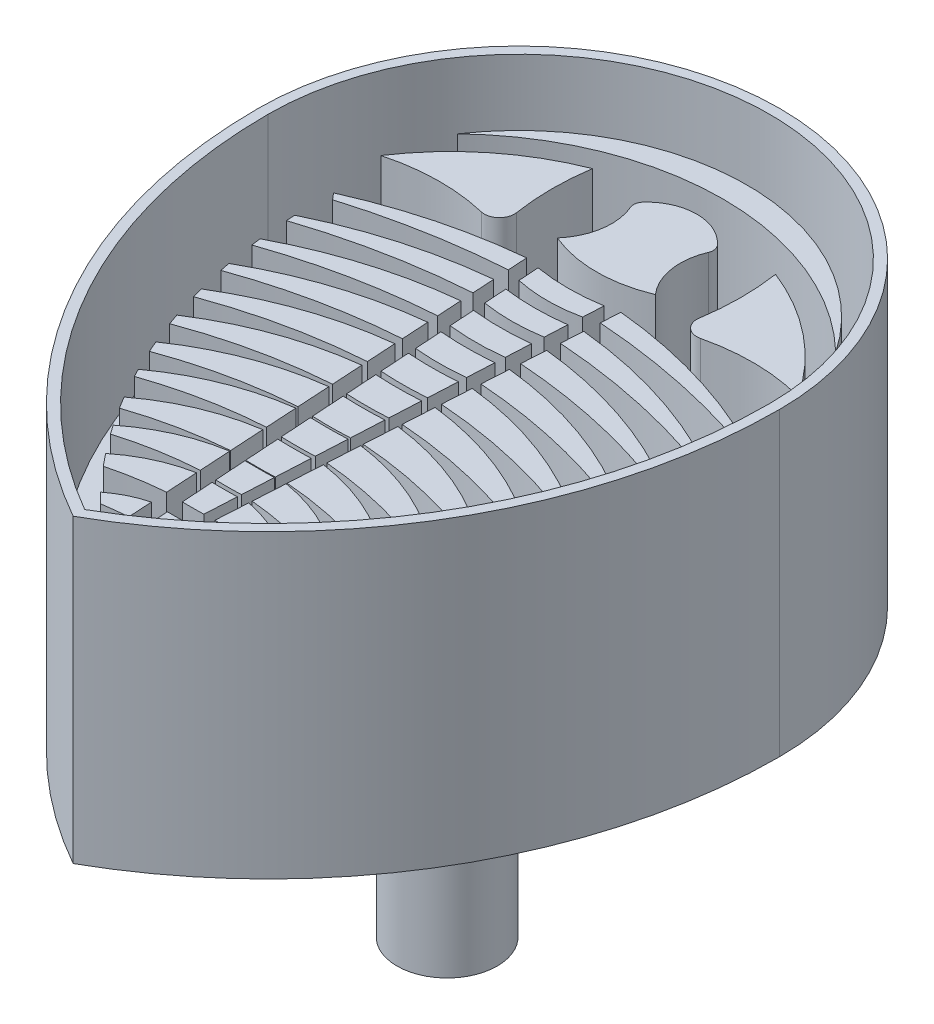
from build123d import *

# Parameters (mm, degrees)
P_IDAT_VYSUNUT_M1_DEPTH     = 3
P_IDAT_VYSUNUT_M2_DEPTH     = 2
VYSUNOUT_TENKOST_NN_1_DEPTH = 3
SKICA4_R                    = 1
P_IDAT_VYSUNUT_M3_DEPTH     = 5
M_TKO2_SCALE                = 10


with BuildPart() as part:
    # Skica1 → Přidat vysunutím1 (new body)
    with BuildSketch(Plane(origin=(0, 0, 0), x_dir=(1, 0, 0), z_dir=(0, 1, 0))):
        with BuildLine():
            ThreePointArc((5, 0), (0, 5), (-5, 0))
            ThreePointArc((-5, 0), (-3.660254038, -5), (0, -8.660254038))
            ThreePointArc((0, -8.660254038), (3.660254038, -5), (5, 0))
        make_face()
    extrude(amount=-P_IDAT_VYSUNUT_M1_DEPTH)

    # Skica2 → Přidat vysunutím2 (add)
    with BuildSketch(Plane(origin=(0, 0, 0), x_dir=(1, 0, 0), z_dir=(0, 1, 0))):
        with BuildLine():
            Line((-0.916308941, 0.705415762), (-0.939566009, 1.094601969))
            ThreePointArc((-0.939566009, 1.094601969), (-2.496070066, 0.816540474), (-3.987598771, 0.291787966))
            ThreePointArc((-3.987598771, 0.291787966), (-3.93376434, 0.226933977), (-3.878875249, 0.162970131))
            ThreePointArc((-3.878875249, 0.162970131), (-2.412884098, 0.517710206), (-0.916308941, 0.705415762))
        make_face()
        with BuildLine():
            ThreePointArc((3.996049018, 0.288019105), (2.500543522, 0.815361092), (0.939566009, 1.094601969))
            Line((0.939566009, 1.094601969), (0.916308941, 0.705415762))
            ThreePointArc((0.916308941, 0.705415762), (2.474795846, 0.50622373), (3.999244676, 0.125941382))
            ThreePointArc((3.999244676, 0.125941382), (3.997959641, 0.206986411), (3.996049018, 0.288019105))
        make_face()
        with BuildLine():
            Line((-0.435047938, -7.348056278), (-0.463870567, -6.865735387))
            ThreePointArc((-0.463870567, -6.865735387), (-0.820283032, -6.998144282), (-1.142178643, -7.200493427))
            ThreePointArc((-1.142178643, -7.200493427), (-1.044053725, -7.303235817), (-0.944547646, -7.404641136))
            ThreePointArc((-0.944547646, -7.404641136), (-0.69047942, -7.370211218), (-0.435047938, -7.348056278))
        make_face()
        with BuildLine():
            Line((-0.48311443, -6.543706568), (-0.52103385, -5.909159033))
            ThreePointArc((-0.52103385, -5.909159033), (-1.175976189, -6.119175526), (-1.759961506, -6.482517714))
            ThreePointArc((-1.759961506, -6.482517714), (-1.662000146, -6.605433643), (-1.56220985, -6.726869431))
            ThreePointArc((-1.56220985, -6.726869431), (-1.026754601, -6.611177456), (-0.48311443, -6.543706568))
        make_face()
        with BuildLine():
            ThreePointArc((1.759961506, -6.482517714), (1.175976189, -6.119175526), (0.52103385, -5.909159033))
            Line((0.52103385, -5.909159033), (0.48311443, -6.543706568))
            ThreePointArc((0.48311443, -6.543706568), (1.026754601, -6.611177456), (1.56220985, -6.726869431))
            ThreePointArc((1.56220985, -6.726869431), (1.662000146, -6.605433643), (1.759961506, -6.482517714))
        make_face()
        with BuildLine():
            Line((-0.525801188, -5.829381897), (-0.563062791, -5.205842323))
            ThreePointArc((-0.563062791, -5.205842323), (-1.413947855, -5.458574562), (-2.173892527, -5.917228103))
            ThreePointArc((-2.173892527, -5.917228103), (-2.111177401, -6.008129807), (-2.04750967, -6.098366866))
            ThreePointArc((-2.04750967, -6.098366866), (-1.294271561, -5.920788208), (-0.525801188, -5.829381897))
        make_face()
        with BuildLine():
            Line((-0.564221505, -5.186452286), (-0.605000226, -4.504056891))
            ThreePointArc((-0.605000226, -4.504056891), (-1.630072172, -4.78948348), (-2.550516325, -5.323359302))
            ThreePointArc((-2.550516325, -5.323359302), (-2.47902439, -5.443080103), (-2.405948876, -5.561840938))
            ThreePointArc((-2.405948876, -5.561840938), (-1.496899189, -5.31618491), (-0.564221505, -5.186452286))
        make_face()
        with BuildLine():
            ThreePointArc((2.550516325, -5.323359302), (1.630072172, -4.78948348), (0.605000226, -4.504056891))
            Line((0.605000226, -4.504056891), (0.564221505, -5.186452286))
            ThreePointArc((0.564221505, -5.186452286), (1.496899189, -5.31618491), (2.405948876, -5.561840938))
            ThreePointArc((2.405948876, -5.561840938), (2.47902439, -5.443080103), (2.550516325, -5.323359302))
        make_face()
        with BuildLine():
            ThreePointArc((2.888337343, -4.702033808), (1.82385638, -4.112337163), (0.646885649, -3.803141834))
            Line((0.646885649, -3.803141834), (0.608773859, -4.440908528))
            ThreePointArc((0.608773859, -4.440908528), (1.70684421, -4.611105365), (2.77208347, -4.927318553))
            ThreePointArc((2.77208347, -4.927318553), (2.83089034, -4.815027047), (2.888337343, -4.702033808))
        make_face()
        with BuildLine():
            Line((-0.609681174, -4.425725417), (-0.646885649, -3.803141834))
            ThreePointArc((-0.646885649, -3.803141834), (-1.82385638, -4.112337163), (-2.888337343, -4.702033808))
            ThreePointArc((-2.888337343, -4.702033808), (-2.846957116, -4.783763443), (-2.804865412, -4.865128946))
            ThreePointArc((-2.804865412, -4.865128946), (-1.722246967, -4.57062129), (-0.609681174, -4.425725417))
        make_face()
        with BuildLine():
            Line((-0.649768137, -3.75490598), (-0.688738665, -3.102769081))
            ThreePointArc((-0.688738665, -3.102769081), (-1.994758332, -3.427574113), (-3.185571439, -4.054590719))
            ThreePointArc((-3.185571439, -4.054590719), (-3.137074616, -4.168548051), (-3.087237062, -4.281925446))
            ThreePointArc((-3.087237062, -4.281925446), (-1.886992142, -3.932901443), (-0.649768137, -3.75490598))
        make_face()
        with BuildLine():
            ThreePointArc((3.185571439, -4.054590719), (1.994758332, -3.427574113), (0.688738665, -3.102769081))
            Line((0.688738665, -3.102769081), (0.649768137, -3.75490598))
            ThreePointArc((0.649768137, -3.75490598), (1.886992142, -3.932901443), (3.087237062, -4.281925446))
            ThreePointArc((3.087237062, -4.281925446), (3.137074616, -4.168548051), (3.185571439, -4.054590719))
        make_face()
        with BuildLine():
            ThreePointArc((3.440254888, -3.38250392), (2.142176753, -2.735637699), (0.730570119, -2.40275715))
            Line((0.730570119, -2.40275715), (0.693500935, -3.023076761))
            ThreePointArc((0.693500935, -3.023076761), (2.048697762, -3.217851436), (3.362758833, -3.602219899))
            ThreePointArc((3.362758833, -3.602219899), (3.402116283, -3.492576859), (3.440254888, -3.38250392))
        make_face()
        with BuildLine():
            Line((-0.693500935, -3.023076761), (-0.730570119, -2.40275715))
            ThreePointArc((-0.730570119, -2.40275715), (-2.142176753, -2.735637699), (-3.440254888, -3.38250392))
            ThreePointArc((-3.440254888, -3.38250392), (-3.402116283, -3.492576859), (-3.362758833, -3.602219899))
            ThreePointArc((-3.362758833, -3.602219899), (-2.048697762, -3.217851436), (-0.693500935, -3.023076761))
        make_face()
        with BuildLine():
            Line((-0.737644723, -2.28436999), (-0.772386499, -1.70299746))
            ThreePointArc((-0.772386499, -1.70299746), (-2.265442062, -2.036978997), (-3.650276137, -2.687358247))
            ThreePointArc((-3.650276137, -2.687358247), (-3.621750205, -2.792878944), (-3.592127328, -2.898096962))
            ThreePointArc((-3.592127328, -2.898096962), (-2.186526172, -2.490583797), (-0.737644723, -2.28436999))
        make_face()
        with BuildLine():
            ThreePointArc((3.650276137, -2.687358247), (2.265442062, -2.036978997), (0.772386499, -1.70299746))
            Line((0.772386499, -1.70299746), (0.737644723, -2.28436999))
            ThreePointArc((0.737644723, -2.28436999), (2.186526172, -2.490583797), (3.592127328, -2.898096962))
            ThreePointArc((3.592127328, -2.898096962), (3.621750205, -2.792878944), (3.650276137, -2.687358247))
        make_face()
        with BuildLine():
            ThreePointArc((3.813377604, -1.970848141), (2.363805986, -1.33206045), (0.814191928, -1.003421043))
            Line((0.814191928, -1.003421043), (0.782080688, -1.540773892))
            ThreePointArc((0.782080688, -1.540773892), (2.299279672, -1.75301782), (3.773049464, -2.17127951))
            ThreePointArc((3.773049464, -2.17127951), (3.793701377, -2.071161983), (3.813377604, -1.970848141))
        make_face()
        with BuildLine():
            Line((-0.782080688, -1.540773892), (-0.814191928, -1.003421043))
            ThreePointArc((-0.814191928, -1.003421043), (-2.363805986, -1.33206045), (-3.813377604, -1.970848141))
            ThreePointArc((-3.813377604, -1.970848141), (-3.793701377, -2.071161983), (-3.773049464, -2.17127951))
            ThreePointArc((-3.773049464, -2.17127951), (-2.299279672, -1.75301782), (-0.782080688, -1.540773892))
        make_face()
        with BuildLine():
            Line((-0.826716789, -0.793828702), (-0.855989148, -0.303981988))
            ThreePointArc((-0.855989148, -0.303981988), (-2.436429093, -0.621360254), (-3.927142449, -1.234787575))
            ThreePointArc((-3.927142449, -1.234787575), (-3.915520245, -1.329262214), (-3.903042076, -1.423627611))
            ThreePointArc((-3.903042076, -1.423627611), (-2.385752794, -1.006769816), (-0.826716789, -0.793828702))
        make_face()
        with BuildLine():
            ThreePointArc((3.927142449, -1.234787575), (2.436429093, -0.621360254), (0.855989148, -0.303981988))
            Line((0.855989148, -0.303981988), (0.826716789, -0.793828702))
            ThreePointArc((0.826716789, -0.793828702), (2.385752794, -1.006769816), (3.903042076, -1.423627611))
            ThreePointArc((3.903042076, -1.423627611), (3.915520245, -1.329262214), (3.927142449, -1.234787575))
        make_face()
        with BuildLine():
            ThreePointArc((3.988971171, -0.481127617), (2.482365461, 0.094622416), (0.897780057, 0.395351462))
            Line((0.897780057, 0.395351462), (0.871479662, -0.044762094))
            ThreePointArc((0.871479662, -0.044762094), (2.444698783, -0.253257558), (3.979415358, -0.657155804))
            ThreePointArc((3.979415358, -0.657155804), (3.984562694, -0.569161766), (3.988971171, -0.481127617))
        make_face()
        with BuildLine():
            Line((-0.871479662, -0.044762094), (-0.897780057, 0.395351462))
            ThreePointArc((-0.897780057, 0.395351462), (-2.482365461, 0.094622416), (-3.988971171, -0.481127617))
            ThreePointArc((-3.988971171, -0.481127617), (-3.984562694, -0.569161766), (-3.979415358, -0.657155804))
            ThreePointArc((-3.979415358, -0.657155804), (-2.444698783, -0.253257558), (-0.871479662, -0.044762094))
        make_face()
        with BuildLine():
            ThreePointArc((1.142178643, -7.200493427), (0.820283032, -6.998144282), (0.463870567, -6.865735387))
            Line((0.463870567, -6.865735387), (0.434044566, -7.364846815))
            ThreePointArc((0.434044566, -7.364846815), (0.674611597, -7.394792085), (0.913565558, -7.435660409))
            ThreePointArc((0.913565558, -7.435660409), (1.028790357, -7.318969583), (1.142178643, -7.200493427))
        make_face()
        with BuildLine():
            ThreePointArc((2.173892527, -5.917228103), (1.413947855, -5.458574562), (0.563062791, -5.205842323))
            Line((0.563062791, -5.205842323), (0.524857999, -5.84516532))
            ThreePointArc((0.524857999, -5.84516532), (1.275900679, -5.956649098), (2.009972467, -6.150639692))
            ThreePointArc((2.009972467, -6.150639692), (2.092725079, -6.034490511), (2.173892527, -5.917228103))
        make_face()
        with BuildLine():
            ThreePointArc((0.662066926, 1.038108349), (0.004161666, 0.983172801), (-0.653856014, 1.036744977))
            Line((-0.653856014, 1.036744977), (-0.627177875, 0.627948759))
            ThreePointArc((-0.627177875, 0.627948759), (0.007047348, 0.561342071), (0.640951077, 0.630941981))
            Line((0.640951077, 0.630941981), (0.662066926, 1.038108349))
        make_face()
        with BuildLine():
            ThreePointArc((0.626415299, 0.350655846), (0.008819368, 0.30865484), (-0.608930115, 0.348333492))
            Line((-0.608930115, 0.348333492), (-0.579458539, -0.103267301))
            ThreePointArc((-0.579458539, -0.103267301), (0.011961322, -0.148953749), (0.60307309, -0.099440312))
            Line((0.60307309, -0.099440312), (0.626415299, 0.350655846))
        make_face()
        with BuildLine():
            Line((0.56489573, -0.835595287), (0.590594924, -0.34005056))
            ThreePointArc((0.590594924, -0.34005056), (0.013466822, -0.372593507), (-0.563817169, -0.342944183))
            Line((-0.563817169, -0.342944183), (-0.531393318, -0.839783468))
            ThreePointArc((-0.531393318, -0.839783468), (0.016881591, -0.871818687), (0.56489573, -0.835595287))
        make_face()
        with BuildLine():
            Line((0.526626446, -1.573522766), (0.554661515, -1.032936542))
            ThreePointArc((0.554661515, -1.032936542), (0.018112597, -1.058353296), (-0.518578705, -1.036145198))
            Line((-0.518578705, -1.036145198), (-0.483230171, -1.577800173))
            ThreePointArc((-0.483230171, -1.577800173), (0.021803285, -1.600485761), (0.526626446, -1.573522766))
        make_face()
        with BuildLine():
            ThreePointArc((0.518646873, -1.727388889), (0.022760192, -1.747313378), (-0.473249622, -1.730734777))
            Line((-0.473249622, -1.730734777), (-0.435139253, -2.3147101))
            ThreePointArc((-0.435139253, -2.3147101), (0.026715844, -2.330778107), (0.488405798, -2.310512426))
            Line((0.488405798, -2.310512426), (0.518646873, -1.727388889))
        make_face()
        with BuildLine():
            ThreePointArc((0.482569539, -2.423050098), (0.027411133, -2.438668883), (-0.42785002, -2.42640495))
            Line((-0.42785002, -2.42640495), (-0.387270501, -3.048215708))
            ThreePointArc((-0.387270501, -3.048215708), (0.031606302, -3.059500446), (0.45035596, -3.044208443))
            Line((0.45035596, -3.044208443), (0.482569539, -2.423050098))
        make_face()
        with BuildLine():
            ThreePointArc((0.410261069, -3.817338207), (0.036726185, -3.826801141), (-0.336874511, -3.820446857))
            Line((-0.336874511, -3.820446857), (-0.296212988, -4.443514195))
            ThreePointArc((-0.296212988, -4.443514195), (0.040912963, -4.448897986), (0.377966169, -4.440064623))
            Line((0.377966169, -4.440064623), (0.410261069, -3.817338207))
        make_face()
        with BuildLine():
            Line((0.412605163, -3.77213821), (0.446439681, -3.119724092))
            ThreePointArc((0.446439681, -3.119724092), (0.032066228, -3.131924709), (-0.382390558, -3.122992379))
            Line((-0.382390558, -3.122992379), (-0.339782943, -3.775880184))
            ThreePointArc((-0.339782943, -3.775880184), (0.036459149, -3.783668202), (0.412605163, -3.77213821))
        make_face()
        with BuildLine():
            Line((0.305409141, -5.839145549), (0.337737111, -5.215781462))
            ThreePointArc((0.337737111, -5.215781462), (0.046065788, -5.221258982), (-0.245643058, -5.218410675))
            Line((-0.245643058, -5.218410675), (-0.20495555, -5.841876176))
            ThreePointArc((-0.20495555, -5.841876176), (0.050245349, -5.843978529), (0.305409141, -5.839145549))
        make_face()
        with BuildLine():
            Line((0.338653865, -5.198104154), (0.374030936, -4.51594575))
            ThreePointArc((0.374030936, -4.51594575), (0.041392047, -4.523203734), (-0.291297367, -4.51883756))
            Line((-0.291297367, -4.51883756), (-0.246767591, -5.20117915))
            ThreePointArc((-0.246767591, -5.20117915), (0.045968856, -5.204538098), (0.338653865, -5.198104154))
        make_face()
        with BuildLine():
            ThreePointArc((0.301348943, -5.917436324), (0.050751597, -5.92147661), (-0.199872475, -5.919765477))
            Line((-0.199872475, -5.919765477), (-0.158480757, -6.55402178))
            ThreePointArc((-0.158480757, -6.55402178), (0.054999827, -6.555115225), (0.268455851, -6.551697388))
            Line((0.268455851, -6.551697388), (0.301348943, -5.917436324))
        make_face()
        with BuildLine():
            ThreePointArc((0.251838147, -6.872128272), (0.057127362, -6.874661622), (-0.137598784, -6.8740018))
            Line((-0.137598784, -6.8740018), (-0.106128968, -7.356222162))
            ThreePointArc((-0.106128968, -7.356222162), (0.060356742, -7.356571612), (0.226828381, -7.354379088))
            Line((0.226828381, -7.354379088), (0.251838147, -6.872128272))
        make_face()
        with BuildLine():
            ThreePointArc((-3.772330851, 2.547069838), (0, 4.070537807), (3.772330851, 2.547069838))
            ThreePointArc((3.772330851, 2.547069838), (0, 4.5517079), (-3.772330851, 2.547069838))
        make_face()
        with BuildLine():
            ThreePointArc((-1.822084639, 1.775573316), (-1.881947184, 2.534148909), (-1.826006026, 3.293023761))
            ThreePointArc((-1.826006026, 3.293023761), (-3.13913069, 2.530148747), (-4.162667451, 1.408254291))
            ThreePointArc((-4.162667451, 1.408254291), (-3.177280617, 1.546631075), (-2.188227529, 1.437501174))
            ThreePointArc((-2.188227529, 1.437501174), (-1.914977273, 1.508870723), (-1.822084639, 1.775573316))
        make_face()
        with BuildLine():
            ThreePointArc((2.188227529, 1.437501174), (3.177280617, 1.546631075), (4.162667451, 1.408254291))
            ThreePointArc((4.162667451, 1.408254291), (3.13913069, 2.530148747), (1.826006026, 3.293023761))
            ThreePointArc((1.826006026, 3.293023761), (1.881947184, 2.534148909), (1.822084639, 1.775573316))
            ThreePointArc((1.822084639, 1.775573316), (1.914977273, 1.508870723), (2.188227529, 1.437501174))
        make_face()
        with BuildLine():
            ThreePointArc((-0.777989506, 3.004550275), (-0.696842448, 2.345663458), (-0.978400549, 1.744463226))
            ThreePointArc((-0.978400549, 1.744463226), (0, 1.547069838), (0.978400549, 1.744463226))
            ThreePointArc((0.978400549, 1.744463226), (0.696842448, 2.345663458), (0.777989506, 3.004550275))
            ThreePointArc((0.777989506, 3.004550275), (0.791260451, 3.115919535), (0.7424957, 3.216920669))
            ThreePointArc((0.7424957, 3.216920669), (0, 3.547069838), (-0.7424957, 3.216920669))
            ThreePointArc((-0.7424957, 3.216920669), (-0.791260451, 3.115919535), (-0.777989506, 3.004550275))
        make_face()
    extrude(amount=P_IDAT_VYSUNUT_M2_DEPTH)



with BuildPart() as body_2:
    # Skica1<2> → Vysunout tenkostěnný1 (new, symmetric)
    with BuildSketch(Plane(origin=(0, 0, 0), x_dir=(1, 0, 0), z_dir=(0, 1, 0))):
        with BuildLine():
            ThreePointArc((5.2, 0), (0, 5.2), (-5.2, 0))
            ThreePointArc((-5.2, 0), (-3.804544281, -5.149757276), (0, -8.890444308))
            ThreePointArc((0, -8.890444308), (3.804544281, -5.149757276), (5.2, 0))
        make_face()
        with BuildLine():
            ThreePointArc((5, 0), (0, 5), (-5, 0))
            ThreePointArc((-5, 0), (-3.660254038, -5), (0, -8.660254038))
            ThreePointArc((0, -8.660254038), (3.660254038, -5), (5, 0))
        make_face(mode=Mode.SUBTRACT)
    extrude(amount=VYSUNOUT_TENKOST_NN_1_DEPTH, both=True)


with BuildPart() as part_1:
    add(part.part)

    add(body_2.part)  # Přidat vysunutím3 merges body 2
    # Skica4 → Přidat vysunutím3 (add)
    with BuildSketch(Plane(origin=(0, -3, 0), x_dir=(-1, 0, 0), z_dir=(0, -1, 0))):
        with Locations((0, -1.431655115)):
            Circle(SKICA4_R)
    extrude(amount=P_IDAT_VYSUNUT_M3_DEPTH)


with BuildPart() as part_2:
    # Měřítko2: scaled about (0, 0, 0)
    add(part_1.part.scale(M_TKO2_SCALE))


solid = part_2.part
